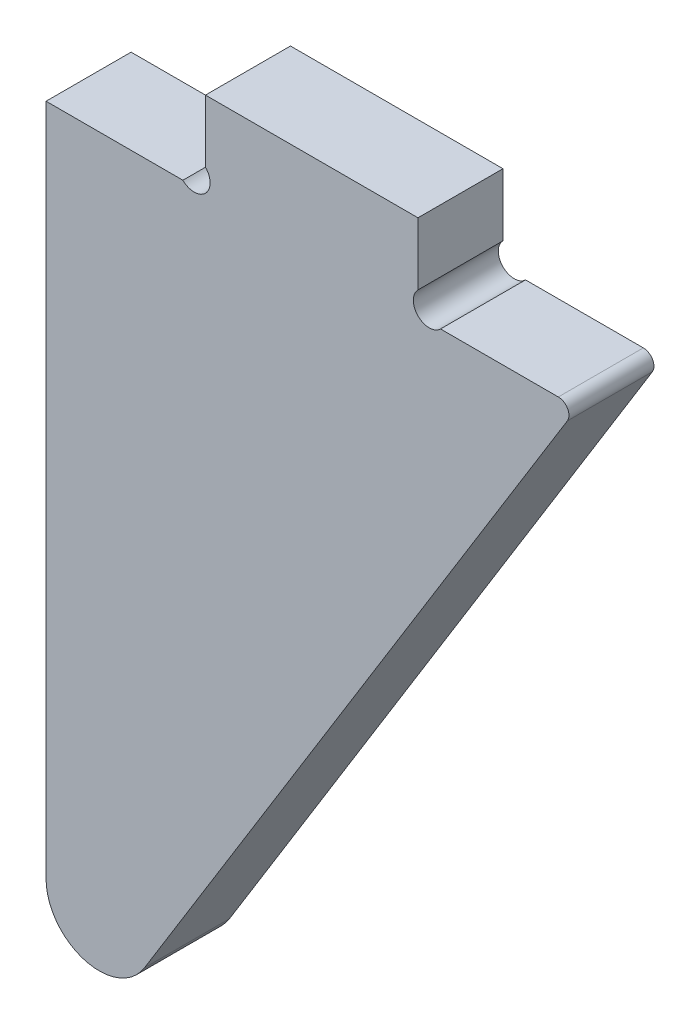
from build123d import *

# Parameters (mm, degrees)
BOSS_EXTRU_1_DEPTH = 8
CONG_1_R           = 5
CONG_2_R           = 1


with BuildPart() as part:
    # Esquisse1 → Boss.-Extru.1 (new body)
    with BuildSketch(Plane.XY):
        with BuildLine():
            Line((0, 0), (0, 81))
            Line((0, 81), (12.878679656, 81))
            ThreePointArc((12.878679656, 81), (15, 81), (15, 83.121320344))
            Line((15, 83.121320344), (15, 89))
            Line((15, 89), (35, 89))
            Line((35, 89), (35, 83.121320344))
            ThreePointArc((35, 83.121320344), (35, 81), (37.121320344, 81))
            Line((37.121320344, 81), (50, 81))
            Line((50, 81), (0, 0))
        make_face()
    extrude(amount=BOSS_EXTRU_1_DEPTH)

    # Congé1
    cong_1_edges = [part.edges().sort_by_distance(p)[0] for p in [
        (0, 0, 4),
    ]]
    fillet(cong_1_edges, radius=CONG_1_R)

    # Congé2
    cong_2_edges = [part.edges().sort_by_distance(p)[0] for p in [
        (50, 81, 4),
    ]]
    fillet(cong_2_edges, radius=CONG_2_R)


solid = part.part
